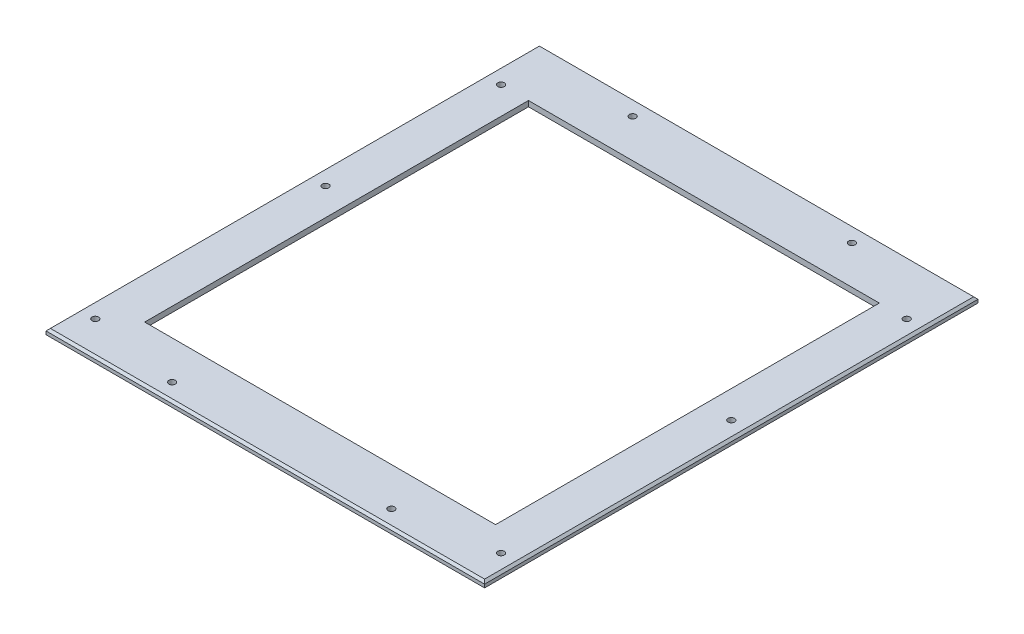
from build123d import *

# Parameters (mm, degrees)
CROQUIS1_W              = 400
CROQUIS1_H              = 450
CROQUIS1_R              = 3
CROQUIS1_W_2            = 320
CROQUIS1_H_2            = 350
SALIENTE_EXTRUIR1_DEPTH = 5
CHAFL_N1_SIZE           = 2


with BuildPart() as part:
    # Croquis1 → Saliente-Extruir1 (new body)
    with BuildSketch(Plane(origin=(0, 0, 0), x_dir=(1, 0, 0), z_dir=(0, 1, 0))):
        with Locations((27.104186234, -42.071984436)):
            Rectangle(CROQUIS1_W, CROQUIS1_H)
        with Locations(Location((-157.895813766, 132.928015564, 0), (0, 0, 270))):
            Circle(CROQUIS1_R, mode=Mode.SUBTRACT)
        with Locations(Location((-157.895813766, -237.071984436, 0), (0, 0, 270))):
            Circle(CROQUIS1_R, mode=Mode.SUBTRACT)
        with Locations(Location((212.104186234, -237.071984436, 0), (0, 0, 270))):
            Circle(CROQUIS1_R, mode=Mode.SUBTRACT)
        with Locations(Location((212.104186234, 132.928015564, 0), (0, 0, 270))):
            Circle(CROQUIS1_R, mode=Mode.SUBTRACT)
        with Locations(Location((-157.895813766, -27.071984436, 0), (0, 0, 270))):
            Circle(CROQUIS1_R, mode=Mode.SUBTRACT)
        with Locations(Location((212.104186234, -27.071984436, 0), (0, 0, 270))):
            Circle(CROQUIS1_R, mode=Mode.SUBTRACT)
        with Locations(Location((-72.895813766, 167.928015564, 0), (0, 0, 270))):
            Circle(CROQUIS1_R, mode=Mode.SUBTRACT)
        with Locations(Location((127.104186234, 167.928015564, 0), (0, 0, 270))):
            Circle(CROQUIS1_R, mode=Mode.SUBTRACT)
        with Locations(Location((127.104186234, -252.071984436, 0), (0, 0, 90))):
            Circle(CROQUIS1_R, mode=Mode.SUBTRACT)
        with Locations(Location((-72.895813766, -252.071984436, 0), (0, 0, 90))):
            Circle(CROQUIS1_R, mode=Mode.SUBTRACT)
        with Locations((27.104186234, -42.071984436)):
            Rectangle(CROQUIS1_W_2, CROQUIS1_H_2, mode=Mode.SUBTRACT)
    extrude(amount=SALIENTE_EXTRUIR1_DEPTH)

    # Chaflán1
    chafl_n1_edges = [part.edges().sort_by_distance(p)[0] for p in [
        (227.104186234, 5, 42.071984436),
        (27.104186234, 5, -182.928015564),
        (-172.895813766, 5, 42.071984436),
        (27.104186234, 5, 267.071984436),
    ]]
    chamfer(chafl_n1_edges, length=CHAFL_N1_SIZE)


solid = part.part
